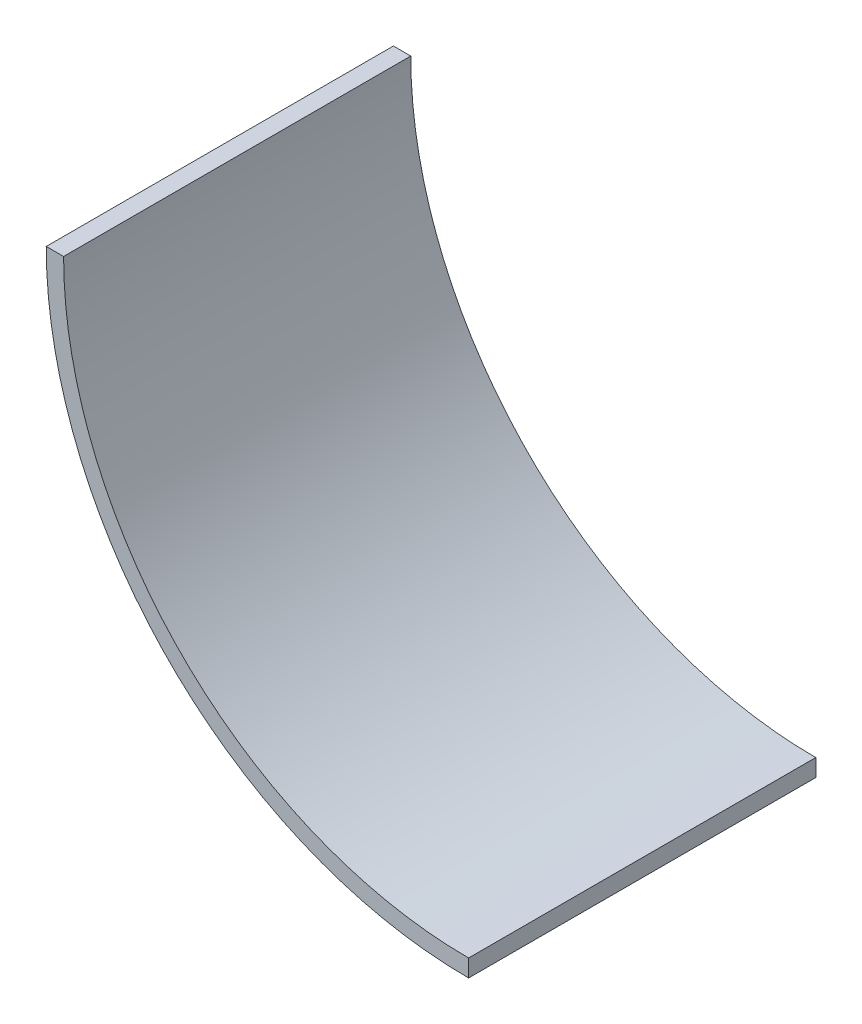
from build123d import *

# Parameters (mm, degrees)
EXTRU_MINCE1_DEPTH = 30


with BuildPart() as part:
    # Esquisse1 → Extru.-Mince1 (new body)
    with BuildSketch(Plane.XY):
        with BuildLine():
            ThreePointArc((-35, 0), (-24.748737342, -24.748737342), (0, -35))
            Line((0, -35), (0, -36.5))
            ThreePointArc((0, -36.5), (-25.809397513, -25.809397513), (-36.5, 0))
            Line((-36.5, 0), (-35, 0))
        make_face()
    extrude(amount=EXTRU_MINCE1_DEPTH)


solid = part.part
